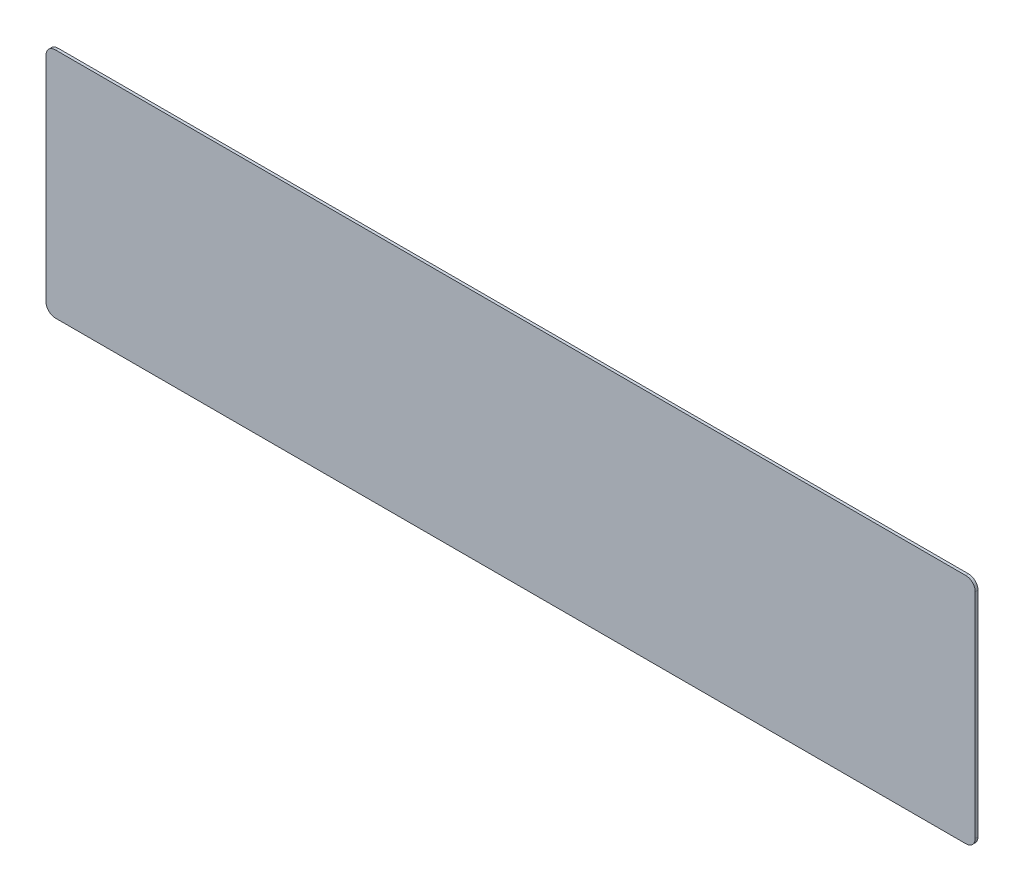
from build123d import *

# Parameters (mm, degrees)
BOSS_EXTRU_1_DEPTH = 3


with BuildPart() as part:
    # Esquisse1 → Boss.-Extru.1 (new body)
    with BuildSketch(Plane.XY):
        with BuildLine():
            Line((694.77885805, -116.462840619), (-285.22114195, -116.462840619))
            ThreePointArc((-285.22114195, -116.462840619), (-292.292209762, -113.533908431), (-295.22114195, -106.462840619))
            Line((-295.22114195, -106.462840619), (-295.22114195, 123.537159381))
            ThreePointArc((-295.22114195, 123.537159381), (-292.292209762, 130.608227193), (-285.22114195, 133.537159381))
            Line((-285.22114195, 133.537159381), (694.77885805, 133.537159381))
            ThreePointArc((694.77885805, 133.537159381), (701.849925862, 130.608227193), (704.77885805, 123.537159381))
            Line((704.77885805, 123.537159381), (704.77885805, -106.462840619))
            ThreePointArc((704.77885805, -106.462840619), (701.849925862, -113.533908431), (694.77885805, -116.462840619))
        make_face()
    extrude(amount=BOSS_EXTRU_1_DEPTH)


solid = part.part
